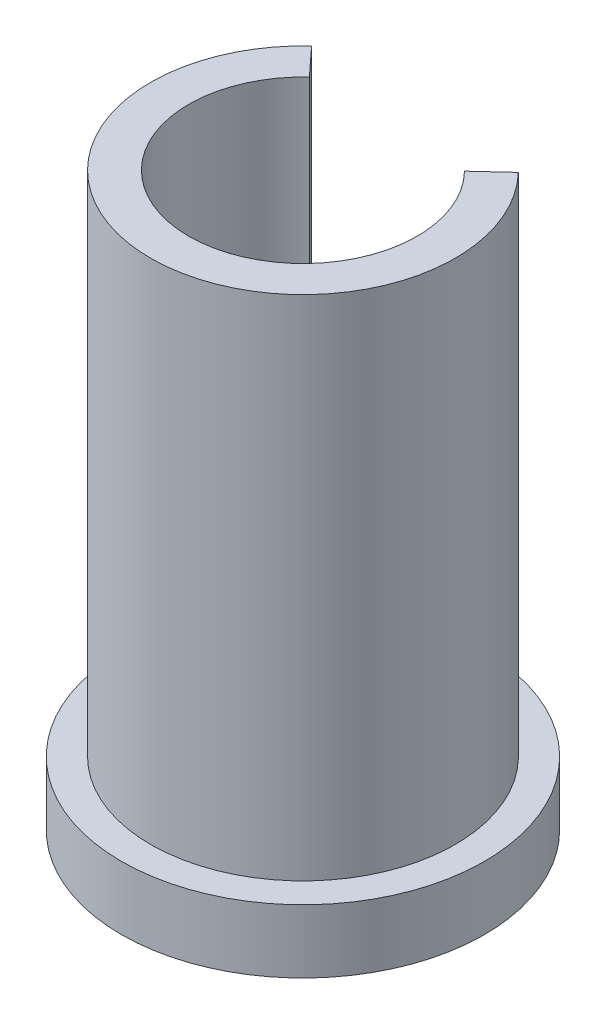
from build123d import *

# Parameters (mm, degrees)
SKETCH1_R           = 14.3
BOSS_EXTRUDE1_DEPTH = 5
SKETCH2_R           = 12
BOSS_EXTRUDE2_DEPTH = 45
SKETCH3_R           = 9
CUT_EXTRUDE1_DEPTH  = 50.33538284
CUT_EXTRUDE3_DEPTH  = 40


with BuildPart() as part:
    # Sketch1 → Boss-Extrude1 (new body)
    with BuildSketch(Plane(origin=(0, 0, 0), x_dir=(1, 0, 0), z_dir=(0, 1, 0))):
        with Locations(Location((0, 0, 0), (0, 0, 270))):
            Circle(SKETCH1_R)
    extrude(amount=BOSS_EXTRUDE1_DEPTH)

    # Sketch2 → Boss-Extrude2 (add)
    with BuildSketch(Plane.XZ):
        with Locations(Location((0, 0, 0), (0, 0, 270))):
            Circle(SKETCH2_R)
    extrude(amount=-BOSS_EXTRUDE2_DEPTH)

    # Sketch3 → Cut-Extrude1 (cut, through all)
    with BuildSketch(Plane(origin=(0, 45, 0), x_dir=(1, 0, 0), z_dir=(0, 1, 0))):
        with Locations(Location((0, 0, 0), (0, 0, 270))):
            Circle(SKETCH3_R)
    extrude(amount=-CUT_EXTRUDE1_DEPTH, mode=Mode.SUBTRACT)

    # Sketch4 → Cut-Extrude3 (cut)
    with BuildSketch(Plane(origin=(0, 45, 0), x_dir=(1, 0, 0), z_dir=(0, 1, 0))):
        with BuildLine():
            Line((-8.842350879, 9.578144326), (-2.340207376, 2.534941703))
            ThreePointArc((-2.340207376, 2.534941703), (0, 3.45), (2.340207376, 2.534941703))
            Line((2.340207376, 2.534941703), (9.389352033, 9.042570774))
            ThreePointArc((9.389352033, 9.042570774), (0.382769282, 13.030023234), (-8.842350879, 9.578144326))
        make_face()
    extrude(amount=-CUT_EXTRUDE3_DEPTH, mode=Mode.SUBTRACT)


solid = part.part
